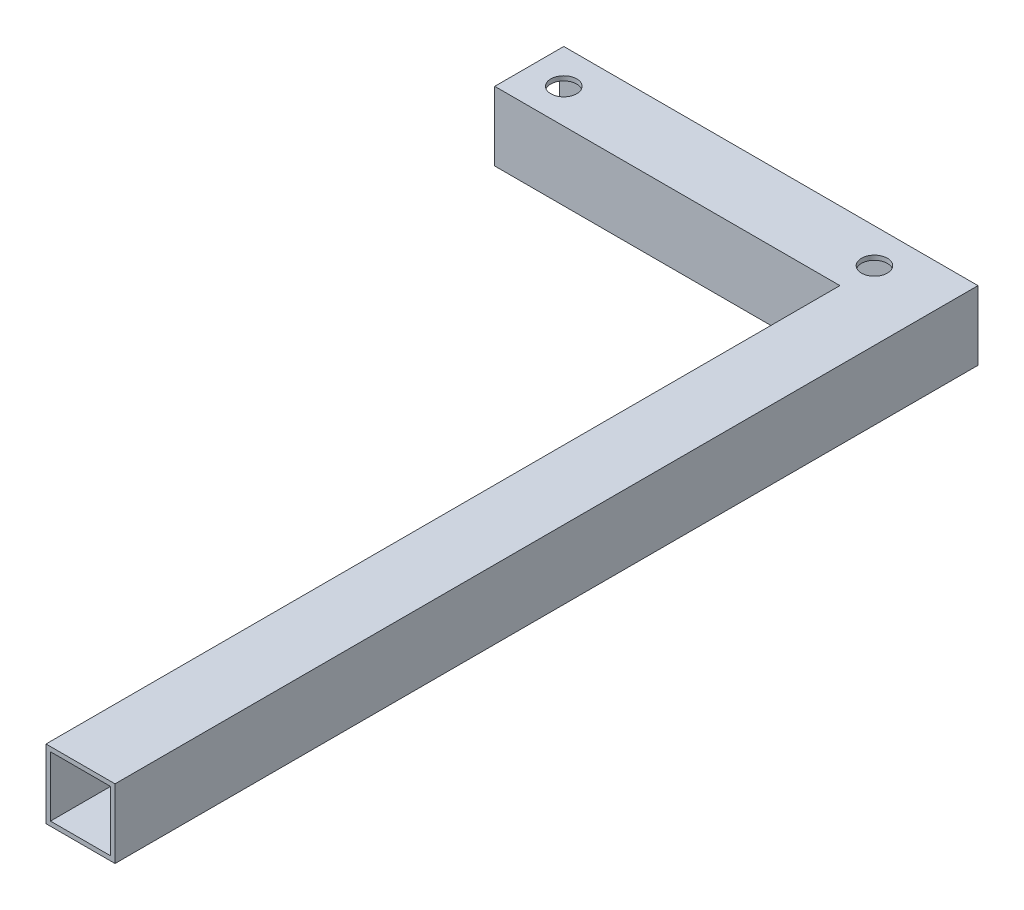
from build123d import *

# Parameters (mm, degrees)
SKETCH1_R           = 4.7625
BOSS_EXTRUDE1_DEPTH = 12.7
SHELL1_T            = -1.651


with BuildPart() as part:
    # Sketch1 → Boss-Extrude1 (new, symmetric)
    with BuildSketch(Plane(origin=(0, 0, 0), x_dir=(1, 0, 0), z_dir=(0, 1, 0))):
        Polygon((-12.7, 12.7), (139.7, 12.7), (139.7, -304.8), (114.3, -304.8), (114.3, -12.7), (-12.7, -12.7), align=None)
        with Locations(Location((0, 0, 0), (0, 0, 270))):
            Circle(SKETCH1_R, mode=Mode.SUBTRACT)
        with Locations(Location((114.3, 0, 0), (0, 0, 270))):
            Circle(SKETCH1_R, mode=Mode.SUBTRACT)
    extrude(amount=BOSS_EXTRUDE1_DEPTH, both=True)

    # Shell1
    shell1_openings = [part.faces().sort_by_distance(p)[0] for p in [
        (127, 0, 304.8),
        (-12.7, 0, 0),
        (0, 0, -4.7625),
        (114.3, 0, -4.7625),
    ]]
    offset(amount=SHELL1_T, openings=shell1_openings, kind=Kind.INTERSECTION)


solid = part.part
